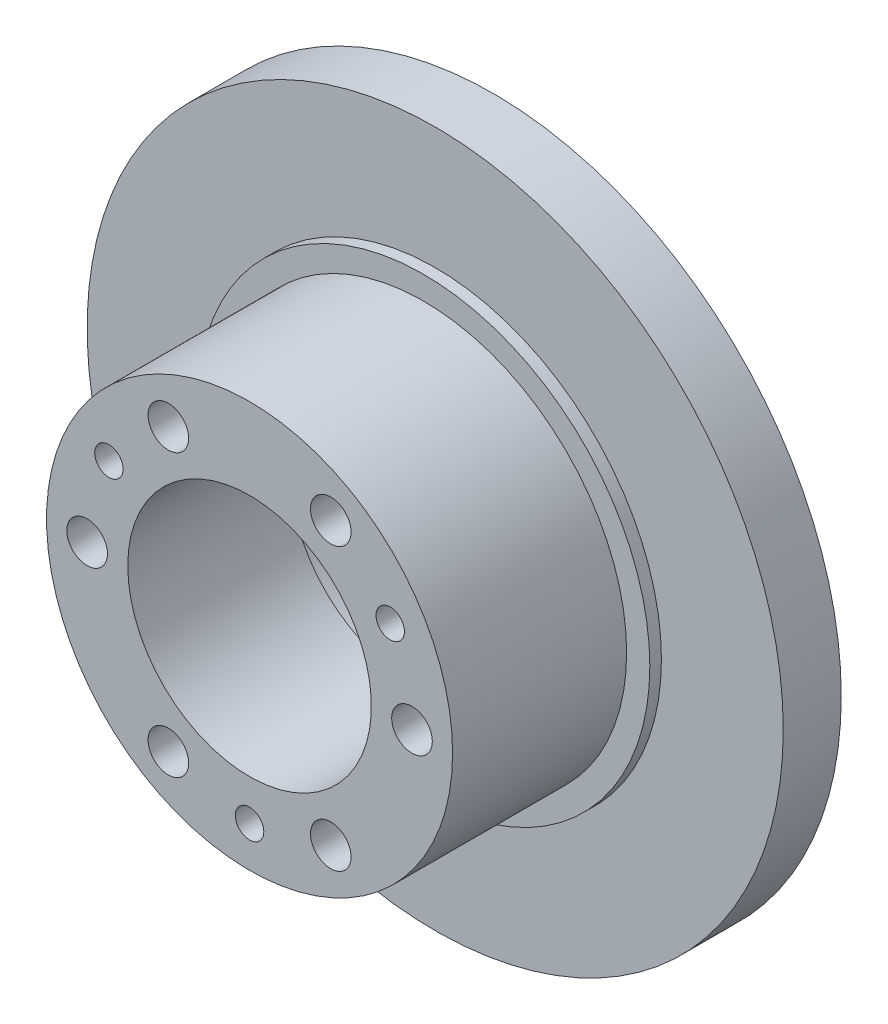
from build123d import *

# Parameters (mm, degrees)
SKETCH1_R               = 30
BOSS_EXTRUDE1_DEPTH     = 5
SKETCH2_R               = 19.5
BOSS_EXTRUDE2_DEPTH     = 1
SKETCH3_R               = 17.5
BOSS_EXTRUDE3_DEPTH     = 15
SKETCH4_R               = 12.025
CUT_EXTRUDE1_DEPTH      = 7
SKETCH5_R               = 10.5
CUT_EXTRUDE2_DEPTH      = 45.676615807
CUT_EXTRUDE3_DEPTH      = 4
CUT_EXTRUDE3_DEPTH_BACK = 4
CUT_EXTRUDE3_START      = -5
SKETCH6_R               = 2
SKETCH7_R               = 1.75
CUT_EXTRUDE4_DEPTH      = 10
SKETCH8_R               = 1.225
CUT_EXTRUDE5_DEPTH      = 12


with BuildPart() as part:
    # Sketch1 → Boss-Extrude1 (new body)
    with BuildSketch(Plane.XY):
        Circle(SKETCH1_R)
    extrude(amount=BOSS_EXTRUDE1_DEPTH)

    # Sketch2 → Boss-Extrude2 (add)
    with BuildSketch(Plane.XY.offset(5)):
        Circle(SKETCH2_R)
    extrude(amount=BOSS_EXTRUDE2_DEPTH)

    # Sketch3 → Boss-Extrude3 (add)
    with BuildSketch(Plane.XY.offset(6)):
        Circle(SKETCH3_R)
    extrude(amount=BOSS_EXTRUDE3_DEPTH)

    # Sketch4 → Cut-Extrude1 (cut)
    with BuildSketch(Plane(origin=(0, 0, 0), x_dir=(-1, 0, 0), z_dir=(0, 0, -1))):
        Circle(SKETCH4_R)
    extrude(amount=-CUT_EXTRUDE1_DEPTH, mode=Mode.SUBTRACT)

    # Sketch5 → Cut-Extrude2 (cut, through all)
    with BuildSketch(Plane(origin=(0, 0, 7), x_dir=(-1, 0, 0), z_dir=(0, 0, -1))):
        Circle(SKETCH5_R)
    extrude(amount=-CUT_EXTRUDE2_DEPTH, mode=Mode.SUBTRACT)

    # Sketch6 → Cut-Extrude3 (cut, two sides: drawn at the far end of the back side and taken through both)
    with BuildSketch(Plane.XY.offset(5).offset(CUT_EXTRUDE3_START - CUT_EXTRUDE3_DEPTH_BACK)):
        with Locations((24.5, 0)):
            Circle(SKETCH6_R)
        with Locations((12.25, -21.217622393)):
            Circle(SKETCH6_R)
        with Locations((-12.25, -21.217622393)):
            Circle(SKETCH6_R)
        with Locations((-24.5, 0)):
            Circle(SKETCH6_R)
        with Locations((-12.25, 21.217622393)):
            Circle(SKETCH6_R)
        with Locations((12.25, 21.217622393)):
            Circle(SKETCH6_R)
    extrude(amount=CUT_EXTRUDE3_DEPTH + CUT_EXTRUDE3_DEPTH_BACK, mode=Mode.SUBTRACT)

    # Sketch7 → Cut-Extrude4 (cut)
    with BuildSketch(Plane.XY.offset(21)):
        with Locations((14, 0)):
            Circle(SKETCH7_R)
        with Locations((7, -12.124355653)):
            Circle(SKETCH7_R)
        with Locations((-7, -12.124355653)):
            Circle(SKETCH7_R)
        with Locations((-14, 0)):
            Circle(SKETCH7_R)
        with Locations((-7, 12.124355653)):
            Circle(SKETCH7_R)
        with Locations((7, 12.124355653)):
            Circle(SKETCH7_R)
    extrude(amount=-CUT_EXTRUDE4_DEPTH, mode=Mode.SUBTRACT)

    # Sketch8 → Cut-Extrude5 (cut)
    with BuildSketch(Plane.XY.offset(21)):
        with Locations((12.124355653, 7)):
            Circle(SKETCH8_R)
        with Locations((0, -14)):
            Circle(SKETCH8_R)
        with Locations((-12.124355653, 7)):
            Circle(SKETCH8_R)
    extrude(amount=-CUT_EXTRUDE5_DEPTH, mode=Mode.SUBTRACT)


solid = part.part
